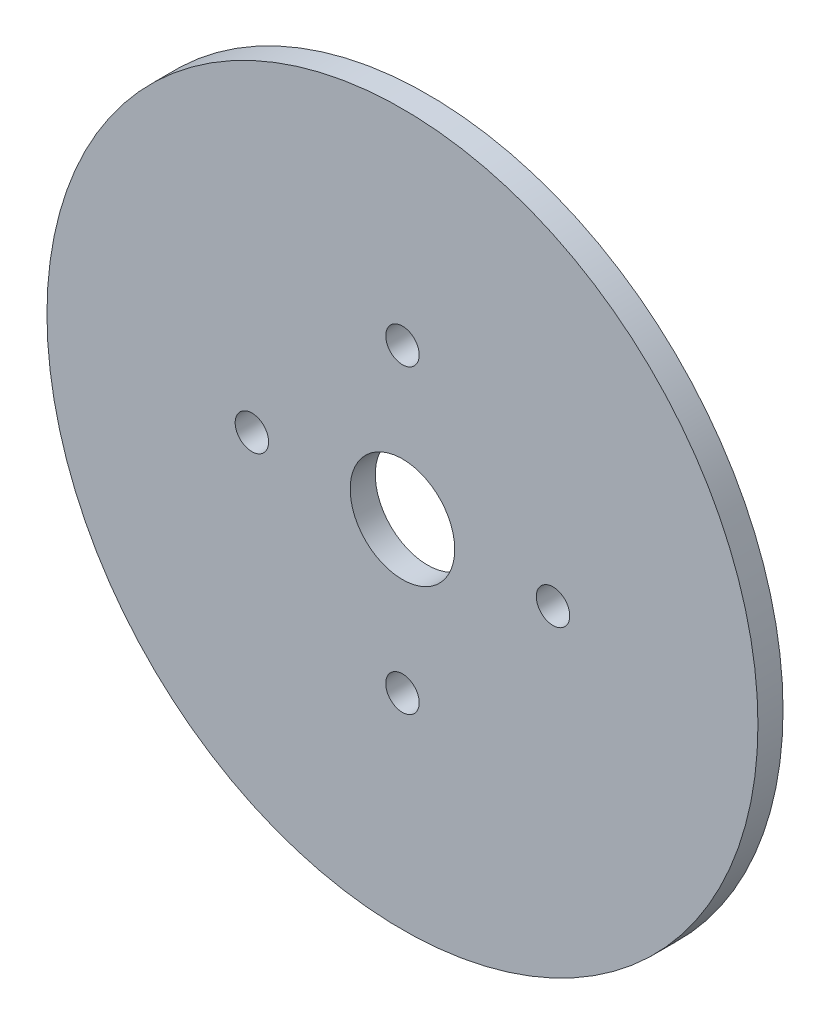
from build123d import *

# Parameters (mm, degrees)
SKETCH1_R           = 85
SKETCH1_R_2         = 12.5
BOSS_EXTRUDE1_DEPTH = 6
SKETCH2_R           = 4
CUT_EXTRUDE1_DEPTH  = 121.357799913


with BuildPart() as part:
    # Sketch1 → Boss-Extrude1 (new body)
    with BuildSketch(Plane.XY):
        Circle(SKETCH1_R)
        Circle(SKETCH1_R_2, mode=Mode.SUBTRACT)
    extrude(amount=BOSS_EXTRUDE1_DEPTH)

    # Sketch2 → Cut-Extrude1 (cut, through all)
    with BuildSketch(Plane.XY.offset(6)):
        with Locations((0, 36)):
            Circle(SKETCH2_R)
        with Locations((36, 0)):
            Circle(SKETCH2_R)
        with Locations((0, -36)):
            Circle(SKETCH2_R)
        with Locations((-36, 0)):
            Circle(SKETCH2_R)
    extrude(amount=-CUT_EXTRUDE1_DEPTH, mode=Mode.SUBTRACT)


solid = part.part
